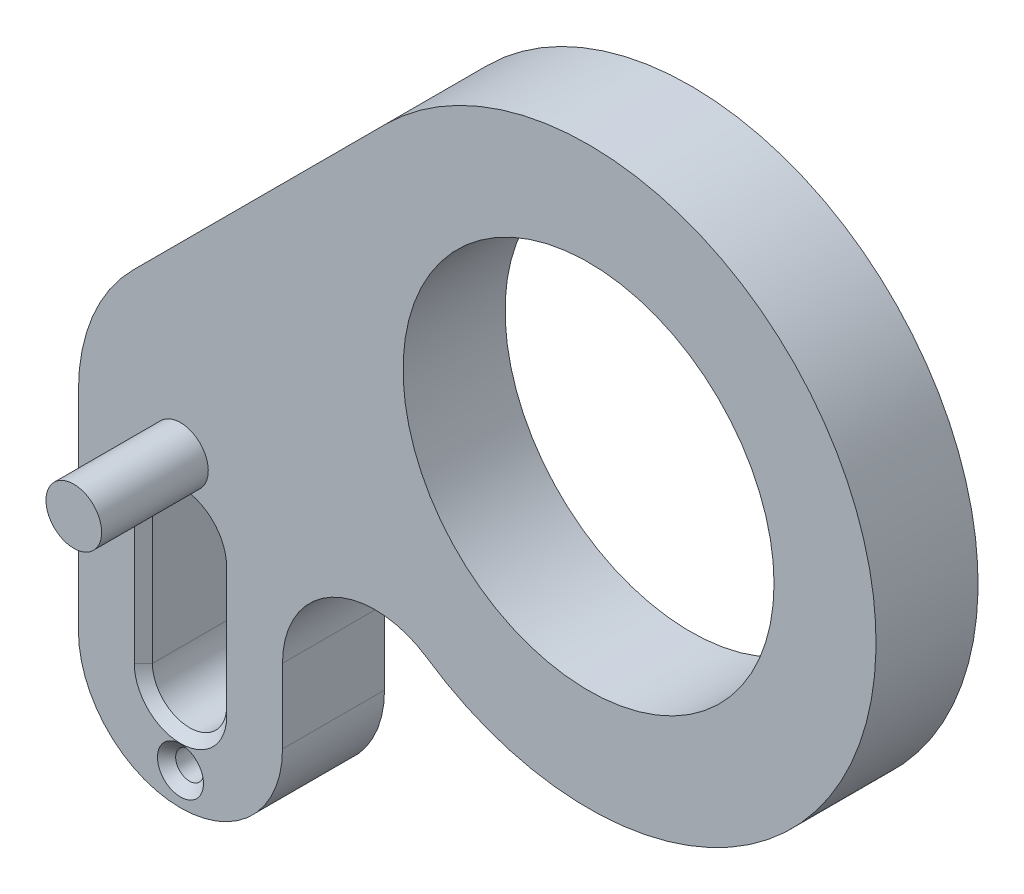
from build123d import *

# Parameters (mm, degrees)
ESQUISSE1_R        = 10
ESQUISSE1_R_2      = 0.75
BOSS_EXTRU_1_DEPTH = 2.75
CHANFREIN1_SIZE    = 0.49
CHANFREIN2_SIZE    = 0.49
ESQUISSE2_R        = 1.5
BOSS_EXTRU_2_DEPTH = 8.5


with BuildPart() as part:
    # Esquisse1 → Boss.-Extru.1 (new, symmetric)
    with BuildSketch(Plane.XY):
        with BuildLine():
            Line((5.5, -3.5), (5.5, 0.5))
            ThreePointArc((5.5, 0.5), (8.157393572, 4.917261043), (13.304878049, 4.639161646))
            ThreePointArc((13.304878049, 4.639161646), (37.430230582, 18.939570643), (11.039844892, 28.430717857))
            Line((11.039844892, 28.430717857), (-2.571067812, 14.819805153))
            ThreePointArc((-2.571067812, 14.819805153), (-4.738795325, 11.575571665), (-5.5, 7.748737342))
            Line((-5.5, 7.748737342), (-5.5, -3.5))
            ThreePointArc((-5.5, -3.5), (0, -9), (5.5, -3.5))
        make_face()
        with Locations((22, 17.470562748)):
            Circle(ESQUISSE1_R, mode=Mode.SUBTRACT)
        with Locations((0, -7.25)):
            Circle(ESQUISSE1_R_2, mode=Mode.SUBTRACT)
        with BuildLine():
            Line((2, 3.5), (2, -3.5))
            ThreePointArc((2, -3.5), (0, -5.5), (-2, -3.5))
            Line((-2, -3.5), (-2, 3.5))
            ThreePointArc((-2, 3.5), (0, 5.5), (2, 3.5))
        make_face(mode=Mode.SUBTRACT)
    extrude(amount=BOSS_EXTRU_1_DEPTH, both=True)

    # Chanfrein1
    chanfrein1_edges = [part.edges().sort_by_distance(p)[0] for p in [
        (0, 5.5, 2.75),
        (-2, 0, 2.75),
        (0, -5.5, 2.75),
        (2, 0, 2.75),
        (-0.75, -7.25, 2.75),
    ]]
    chamfer(chanfrein1_edges, length=CHANFREIN1_SIZE)

    # Chanfrein2
    chanfrein2_edges = [part.edges().sort_by_distance(p)[0] for p in [
        (0, 5.5, -2.75),
        (-2, 0, -2.75),
        (0, -5.5, -2.75),
        (2, 0, -2.75),
        (-0.75, -7.25, -2.75),
    ]]
    chamfer(chanfrein2_edges, length=CHANFREIN2_SIZE)

    # Esquisse2 → Boss.-Extru.2 (add, symmetric)
    with BuildSketch(Plane.XY):
        with Locations(Location((0, 7.49, 0), (0, 0, 270.000522617))):
            Circle(ESQUISSE2_R)
    extrude(amount=BOSS_EXTRU_2_DEPTH, both=True)


solid = part.part
